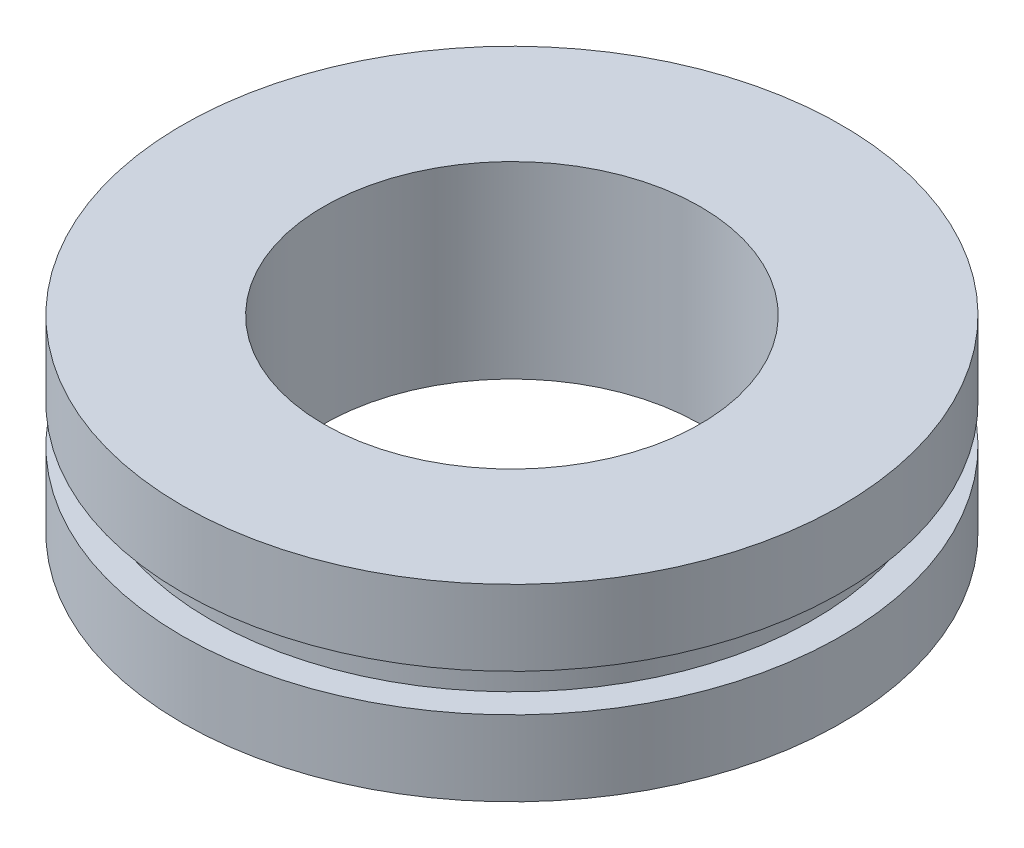
from build123d import *

# Parameters (mm, degrees)
SKETCH_1_R          = 17.5
SKETCH_1_R_2        = 10
EXTRUDE_1_DEPTH     = 10
SKETCH_4_R          = 17.5
SKETCH_4_R_2        = 16
CUT_EXTRUDE_1_DEPTH = 1


with BuildPart() as part:
    # 草图1 → 凸台-拉伸1 (new body)
    with BuildSketch(Plane(origin=(0, 0, 0), x_dir=(1, 0, 0), z_dir=(0, 1, 0))):
        with Locations(Location((0, 0, 0), (0, 0, 270))):
            Circle(SKETCH_1_R)
        with Locations(Location((0, 0, 0), (0, 0, 270))):
            Circle(SKETCH_1_R_2, mode=Mode.SUBTRACT)
    extrude(amount=EXTRUDE_1_DEPTH)

    # 草图4 → 切除-拉伸1 (cut, symmetric)
    with BuildSketch(Plane(origin=(0, 5, 0), x_dir=(1, 0, 0), z_dir=(0, 1, 0))):
        with Locations(Location((0, 0, 0), (0, 0, 270))):
            Circle(SKETCH_4_R)
        with Locations(Location((0, 0, 0), (0, 0, 270))):
            Circle(SKETCH_4_R_2, mode=Mode.SUBTRACT)
    extrude(amount=CUT_EXTRUDE_1_DEPTH, both=True, mode=Mode.SUBTRACT)


solid = part.part
